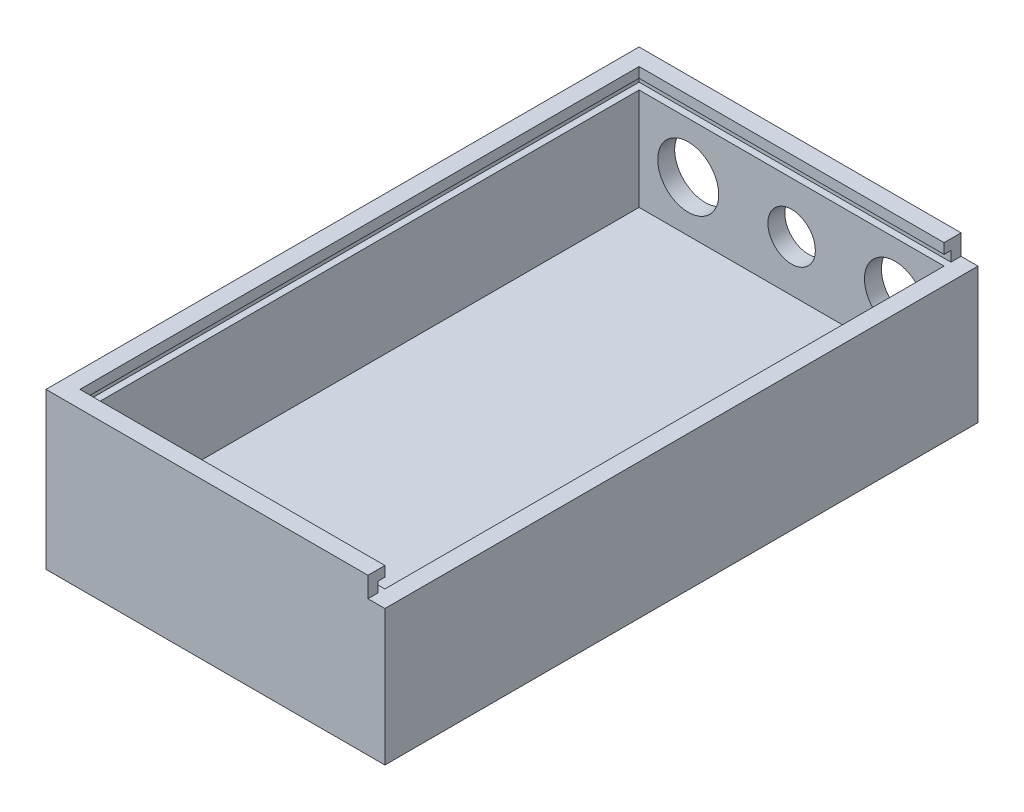
from build123d import *

# Parameters (mm, degrees)
SKETCH1_W           = 100
SKETCH1_H           = 40
BOSS_EXTRUDE1_DEPTH = 175
SKETCH2_W           = 90
SKETCH2_H           = 165
CUT_EXTRUDE1_DEPTH  = 30
SKETCH18_R          = 7
SKETCH18_R_2        = 9
CUT_EXTRUDE9_DEPTH  = 10
BOSS_EXTRUDE3_DEPTH = 6
SKETCH27_W          = 2
SKETCH27_H          = 3
CUT_EXTRUDE13_DEPTH = 92
SKETCH28_W          = 2
SKETCH28_H          = 3
CUT_EXTRUDE14_DEPTH = 92
SKETCH29_W          = 165
SKETCH29_H          = 3
CUT_EXTRUDE15_DEPTH = 2


with BuildPart() as part:
    # Sketch1 → Boss-Extrude1 (new body)
    with BuildSketch(Plane.XY):
        with Locations((6.252485089, -6.669980119)):
            Rectangle(SKETCH1_W, SKETCH1_H)
    extrude(amount=BOSS_EXTRUDE1_DEPTH)

    # Sketch2 → Cut-Extrude1 (cut)
    with BuildSketch(Plane(origin=(0, 13.330019881, 0), x_dir=(1, 0, 0), z_dir=(0, 1, 0))):
        with Locations((6.252485089, -87.5)):
            Rectangle(SKETCH2_W, SKETCH2_H)
    extrude(amount=-CUT_EXTRUDE1_DEPTH, mode=Mode.SUBTRACT)

    # Sketch18 → Cut-Extrude9 (cut)
    with BuildSketch(Plane.XY):
        with Locations((6.252485089, -1.669980119)):
            Circle(SKETCH18_R)
        with Locations((36.752485089, -1.669980119)):
            Circle(SKETCH18_R_2)
        with Locations((-24.247514911, -1.669980119)):
            Circle(SKETCH18_R_2)
    extrude(amount=CUT_EXTRUDE9_DEPTH, mode=Mode.SUBTRACT)

    # Sketch26 → Boss-Extrude3 (add)
    with BuildSketch(Plane(origin=(0, 13.330019881, 0), x_dir=(1, 0, 0), z_dir=(0, 1, 0))):
        Polygon((51.252485089, -5), (-38.747514911, -5), (-38.747514911, -170), (51.252485089, -170), (51.252485089, -175), (-43.747514911, -175), (-43.747514911, 0), (51.252485089, 0), align=None)
    extrude(amount=BOSS_EXTRUDE3_DEPTH)

    # Sketch27 → Cut-Extrude13 (cut)
    with BuildSketch(Plane(origin=(51.252485089, 0, 0), x_dir=(0, 0, -1), z_dir=(1, 0, 0))):
        with Locations((-171, 14.830019881)):
            Rectangle(SKETCH27_W, SKETCH27_H)
    extrude(amount=-CUT_EXTRUDE13_DEPTH, mode=Mode.SUBTRACT)

    # Sketch28 → Cut-Extrude14 (cut)
    with BuildSketch(Plane(origin=(51.252485089, 0, 0), x_dir=(0, 0, -1), z_dir=(1, 0, 0))):
        with Locations((-4, 14.830019881)):
            Rectangle(SKETCH28_W, SKETCH28_H)
    extrude(amount=-CUT_EXTRUDE14_DEPTH, mode=Mode.SUBTRACT)

    # Sketch29 → Cut-Extrude15 (cut)
    with BuildSketch(Plane(origin=(-38.747514911, 0, 0), x_dir=(0, 0, -1), z_dir=(1, 0, 0))):
        with Locations((-87.5, 14.830019881)):
            Rectangle(SKETCH29_W, SKETCH29_H)
    extrude(amount=-CUT_EXTRUDE15_DEPTH, mode=Mode.SUBTRACT)


solid = part.part
